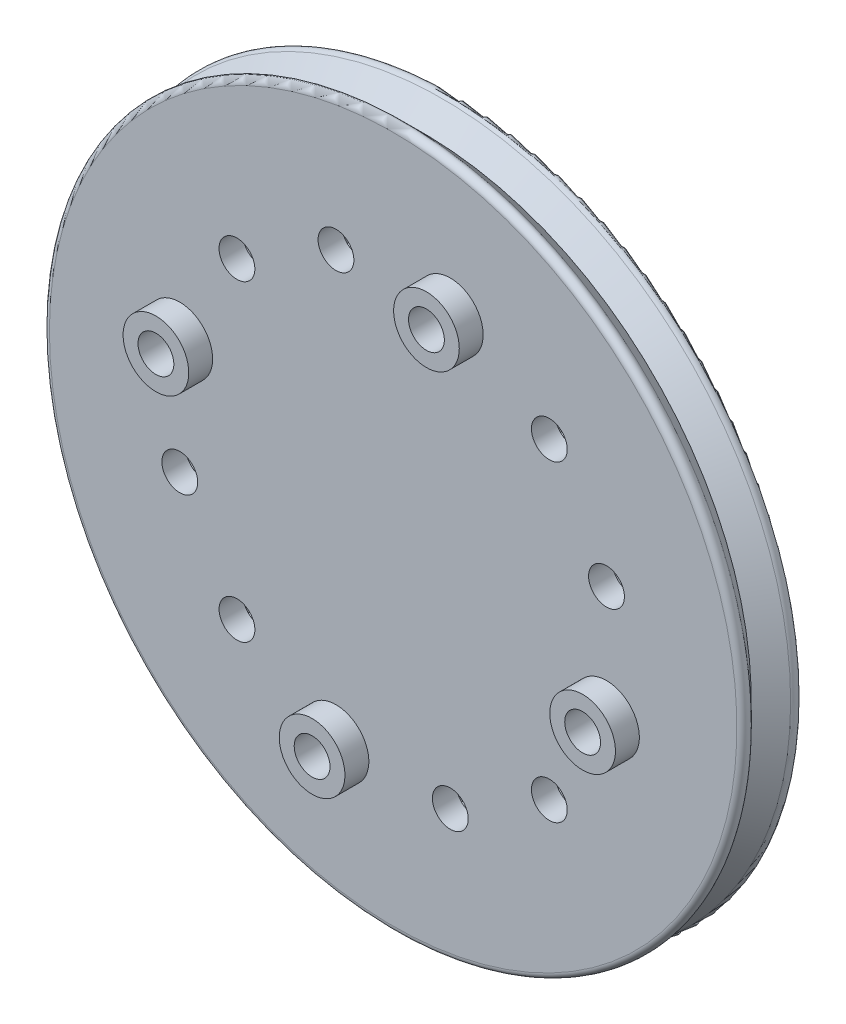
from build123d import *

# Parameters (mm, degrees)
SKETCH_3_R                         = 2.75
EXTRUDE_1_DEPTH                    = 2
PATTERN_CIRCULAR_1_COUNT           = 4
SKETCH_7_R                         = 1.5
CUT_EXTRUDE_3_DEPTH                = 10
CUT_EXTRUDE_4_DEPTH                = 3
PATTERN_CIRCULAR_3_COUNT           = 3
PATTERN_CIRCULAR_3_ANGLE           = 60
PATTERN_CIRCULAR_4_COUNT           = 4
PATTERN_CIRCULAR_4_COPY_1_SKETCH_R = 1.5
PATTERN_CIRCULAR_4_COPY_1_DEPTH    = 10
PATTERN_CIRCULAR_4_COPY_2_SKETCH_R = 1.5
PATTERN_CIRCULAR_4_COPY_2_DEPTH    = 10
PATTERN_CIRCULAR_4_COPY_3_SKETCH_R = 1.5
PATTERN_CIRCULAR_4_COPY_3_DEPTH    = 10
PATTERN_CIRCULAR_4_COPY_4_SKETCH_R = 1.5
PATTERN_CIRCULAR_4_COPY_4_DEPTH    = 10
PATTERN_CIRCULAR_4_COPY_5_SKETCH_R = 1.5
PATTERN_CIRCULAR_4_COPY_5_DEPTH    = 10
PATTERN_CIRCULAR_4_COPY_6_SKETCH_R = 1.5
PATTERN_CIRCULAR_4_COPY_6_DEPTH    = 10
PATTERN_CIRCULAR_4_COPY_7_DEPTH    = 3
PATTERN_CIRCULAR_4_COPY_8_DEPTH    = 3
PATTERN_CIRCULAR_4_COPY_9_DEPTH    = 3
PATTERN_CIRCULAR_4_COPY_10_DEPTH   = 3
PATTERN_CIRCULAR_4_COPY_11_DEPTH   = 3
PATTERN_CIRCULAR_4_COPY_12_DEPTH   = 3
FILLET_1_R                         = 0.5


with BuildPart() as part:
    # 草图2 → 旋转1 (revolve)
    with BuildSketch(Plane(origin=(0, 0, 0), x_dir=(1, 0, 0), z_dir=(0, 1, 0)), mode=Mode.PRIVATE) as revolve_1_sk:
        Polygon((0, -2.5), (30, -2.5), (27.5, 0), (30, 2.5), (0, 2.5), align=None)
    revolve(revolve_1_sk.sketch.rotate(Axis((0, 0, -2.5), (0, 0, 1)), 180), axis=Axis((0, 0, -2.5), (0, 0, 1)))

    # 草图3 → 凸台-拉伸1 (add)
    with BuildSketch(Plane.XY.offset(2.5)):
        with Locations(Location((4.788152334, 17.869627786, 0), (0, 0, 180))):
            Circle(SKETCH_3_R)
    extrude_1 = extrude(amount=EXTRUDE_1_DEPTH)

    # 阵列(圆周)1: 凸台-拉伸1 ×4 about axis
    pattern_circular_1_axis = Axis((0, 0, 0), (0, 0, 1))
    for i in range(1, PATTERN_CIRCULAR_1_COUNT):
        add(extrude_1.rotate(pattern_circular_1_axis, i * 360 / PATTERN_CIRCULAR_1_COUNT))

    # 草图7 → 切除-拉伸3 (cut)
    with BuildSketch(Plane(origin=(0, 0, -2.5), x_dir=(-1, 0, 0), z_dir=(0, 0, -1))):
        with Locations((4.788152334, 17.869627786)):
            Circle(SKETCH_7_R)
    cut_extrude_3 = extrude(amount=-CUT_EXTRUDE_3_DEPTH, mode=Mode.SUBTRACT)

    # 草图8 → 切除-拉伸4 (cut)
    with BuildSketch(Plane(origin=(0, 0, -2.5), x_dir=(-1, 0, 0), z_dir=(0, 0, -1))):
        Polygon((3.966291485, 14.802401339), (7.033517932, 15.624262189), (7.855378781, 18.691488636), (5.610013184, 20.936854233), (2.542786737, 20.114993384), (1.720925887, 17.047766937), align=None)
    cut_extrude_4 = extrude(amount=-CUT_EXTRUDE_4_DEPTH, mode=Mode.SUBTRACT)

    # 阵列(圆周)3: 切除-拉伸3, 切除-拉伸4 ×3 about axis
    pattern_circular_3_axis = Axis((0, 0, 0), (0, 0, 1))
    add([cut_extrude_3.rotate(pattern_circular_3_axis, i * PATTERN_CIRCULAR_3_ANGLE / (PATTERN_CIRCULAR_3_COUNT - 1)) for i in range(1, PATTERN_CIRCULAR_3_COUNT)], mode=Mode.SUBTRACT)
    add([cut_extrude_4.rotate(pattern_circular_3_axis, i * PATTERN_CIRCULAR_3_ANGLE / (PATTERN_CIRCULAR_3_COUNT - 1)) for i in range(1, PATTERN_CIRCULAR_3_COUNT)], mode=Mode.SUBTRACT)

    # 阵列(圆周)4: 切除-拉伸3, 切除-拉伸4 ×4 about axis
    pattern_circular_4_axis = Axis((0, 0, 2.5), (0, 0, -1))
    add([cut_extrude_3.rotate(pattern_circular_4_axis, i * 360 / PATTERN_CIRCULAR_4_COUNT) for i in range(1, PATTERN_CIRCULAR_4_COUNT)], mode=Mode.SUBTRACT)
    add([cut_extrude_4.rotate(pattern_circular_4_axis, i * 360 / PATTERN_CIRCULAR_4_COUNT) for i in range(1, PATTERN_CIRCULAR_4_COUNT)], mode=Mode.SUBTRACT)

    # 阵列(圆周)4 copy 1 sketch → 阵列(圆周)4 copy 1 (cut)
    with BuildSketch(Plane(origin=(0, 0, -2.5), x_dir=(-0.5000000000000011, 0.866025403784438, 0), z_dir=(0, 0, -1))):
        with Locations((4.788152334, 17.869627786)):
            Circle(PATTERN_CIRCULAR_4_COPY_1_SKETCH_R)
    extrude(amount=-PATTERN_CIRCULAR_4_COPY_1_DEPTH, mode=Mode.SUBTRACT)

    # 阵列(圆周)4 copy 2 sketch → 阵列(圆周)4 copy 2 (cut)
    with BuildSketch(Plane(origin=(0, 0, -2.5), x_dir=(0.8660254037844379, 0.5000000000000012, 0), z_dir=(0, 0, -1))):
        with Locations((4.788152334, 17.869627786)):
            Circle(PATTERN_CIRCULAR_4_COPY_2_SKETCH_R)
    extrude(amount=-PATTERN_CIRCULAR_4_COPY_2_DEPTH, mode=Mode.SUBTRACT)

    # 阵列(圆周)4 copy 3 sketch → 阵列(圆周)4 copy 3 (cut)
    with BuildSketch(Plane(origin=(0, 0, -2.5), x_dir=(0.5000000000000012, -0.8660254037844379, 0), z_dir=(0, 0, -1))):
        with Locations((4.788152334, 17.869627786)):
            Circle(PATTERN_CIRCULAR_4_COPY_3_SKETCH_R)
    extrude(amount=-PATTERN_CIRCULAR_4_COPY_3_DEPTH, mode=Mode.SUBTRACT)

    # 阵列(圆周)4 copy 4 sketch → 阵列(圆周)4 copy 4 (cut)
    with BuildSketch(Plane(origin=(0, 0, -2.5), x_dir=(-0.8660254037844399, 0.4999999999999977, 0), z_dir=(0, 0, -1))):
        with Locations((4.788152334, 17.869627786)):
            Circle(PATTERN_CIRCULAR_4_COPY_4_SKETCH_R)
    extrude(amount=-PATTERN_CIRCULAR_4_COPY_4_DEPTH, mode=Mode.SUBTRACT)

    # 阵列(圆周)4 copy 5 sketch → 阵列(圆周)4 copy 5 (cut)
    with BuildSketch(Plane(origin=(0, 0, -2.5), x_dir=(0.49999999999999767, 0.86602540378444, 0), z_dir=(0, 0, -1))):
        with Locations((4.788152334, 17.869627786)):
            Circle(PATTERN_CIRCULAR_4_COPY_5_SKETCH_R)
    extrude(amount=-PATTERN_CIRCULAR_4_COPY_5_DEPTH, mode=Mode.SUBTRACT)

    # 阵列(圆周)4 copy 6 sketch → 阵列(圆周)4 copy 6 (cut)
    with BuildSketch(Plane(origin=(0, 0, -2.5), x_dir=(0.86602540378444, -0.4999999999999976, 0), z_dir=(0, 0, -1))):
        with Locations((4.788152334, 17.869627786)):
            Circle(PATTERN_CIRCULAR_4_COPY_6_SKETCH_R)
    extrude(amount=-PATTERN_CIRCULAR_4_COPY_6_DEPTH, mode=Mode.SUBTRACT)

    # 阵列(圆周)4 copy 7 sketch → 阵列(圆周)4 copy 7 (cut)
    with BuildSketch(Plane(origin=(0, 0, -2.5), x_dir=(-0.5000000000000011, 0.866025403784438, 0), z_dir=(0, 0, -1))):
        Polygon((3.966291485, 14.802401339), (7.033517932, 15.624262189), (7.855378781, 18.691488636), (5.610013184, 20.936854233), (2.542786737, 20.114993384), (1.720925887, 17.047766937), align=None)
    extrude(amount=-PATTERN_CIRCULAR_4_COPY_7_DEPTH, mode=Mode.SUBTRACT)

    # 阵列(圆周)4 copy 8 sketch → 阵列(圆周)4 copy 8 (cut)
    with BuildSketch(Plane(origin=(0, 0, -2.5), x_dir=(0.8660254037844379, 0.5000000000000012, 0), z_dir=(0, 0, -1))):
        Polygon((3.966291485, 14.802401339), (7.033517932, 15.624262189), (7.855378781, 18.691488636), (5.610013184, 20.936854233), (2.542786737, 20.114993384), (1.720925887, 17.047766937), align=None)
    extrude(amount=-PATTERN_CIRCULAR_4_COPY_8_DEPTH, mode=Mode.SUBTRACT)

    # 阵列(圆周)4 copy 9 sketch → 阵列(圆周)4 copy 9 (cut)
    with BuildSketch(Plane(origin=(0, 0, -2.5), x_dir=(0.5000000000000012, -0.8660254037844379, 0), z_dir=(0, 0, -1))):
        Polygon((3.966291485, 14.802401339), (7.033517932, 15.624262189), (7.855378781, 18.691488636), (5.610013184, 20.936854233), (2.542786737, 20.114993384), (1.720925887, 17.047766937), align=None)
    extrude(amount=-PATTERN_CIRCULAR_4_COPY_9_DEPTH, mode=Mode.SUBTRACT)

    # 阵列(圆周)4 copy 10 sketch → 阵列(圆周)4 copy 10 (cut)
    with BuildSketch(Plane(origin=(0, 0, -2.5), x_dir=(-0.8660254037844399, 0.4999999999999977, 0), z_dir=(0, 0, -1))):
        Polygon((3.966291485, 14.802401339), (7.033517932, 15.624262189), (7.855378781, 18.691488636), (5.610013184, 20.936854233), (2.542786737, 20.114993384), (1.720925887, 17.047766937), align=None)
    extrude(amount=-PATTERN_CIRCULAR_4_COPY_10_DEPTH, mode=Mode.SUBTRACT)

    # 阵列(圆周)4 copy 11 sketch → 阵列(圆周)4 copy 11 (cut)
    with BuildSketch(Plane(origin=(0, 0, -2.5), x_dir=(0.49999999999999767, 0.86602540378444, 0), z_dir=(0, 0, -1))):
        Polygon((3.966291485, 14.802401339), (7.033517932, 15.624262189), (7.855378781, 18.691488636), (5.610013184, 20.936854233), (2.542786737, 20.114993384), (1.720925887, 17.047766937), align=None)
    extrude(amount=-PATTERN_CIRCULAR_4_COPY_11_DEPTH, mode=Mode.SUBTRACT)

    # 阵列(圆周)4 copy 12 sketch → 阵列(圆周)4 copy 12 (cut)
    with BuildSketch(Plane(origin=(0, 0, -2.5), x_dir=(0.86602540378444, -0.4999999999999976, 0), z_dir=(0, 0, -1))):
        Polygon((3.966291485, 14.802401339), (7.033517932, 15.624262189), (7.855378781, 18.691488636), (5.610013184, 20.936854233), (2.542786737, 20.114993384), (1.720925887, 17.047766937), align=None)
    extrude(amount=-PATTERN_CIRCULAR_4_COPY_12_DEPTH, mode=Mode.SUBTRACT)

    # 圆角1
    fillet_1_edges = [part.edges().sort_by_distance(p)[0] for p in [
        (30, 0, -2.5),
        (30, 0, 2.5),
    ]]
    fillet(fillet_1_edges, radius=FILLET_1_R)


solid = part.part
